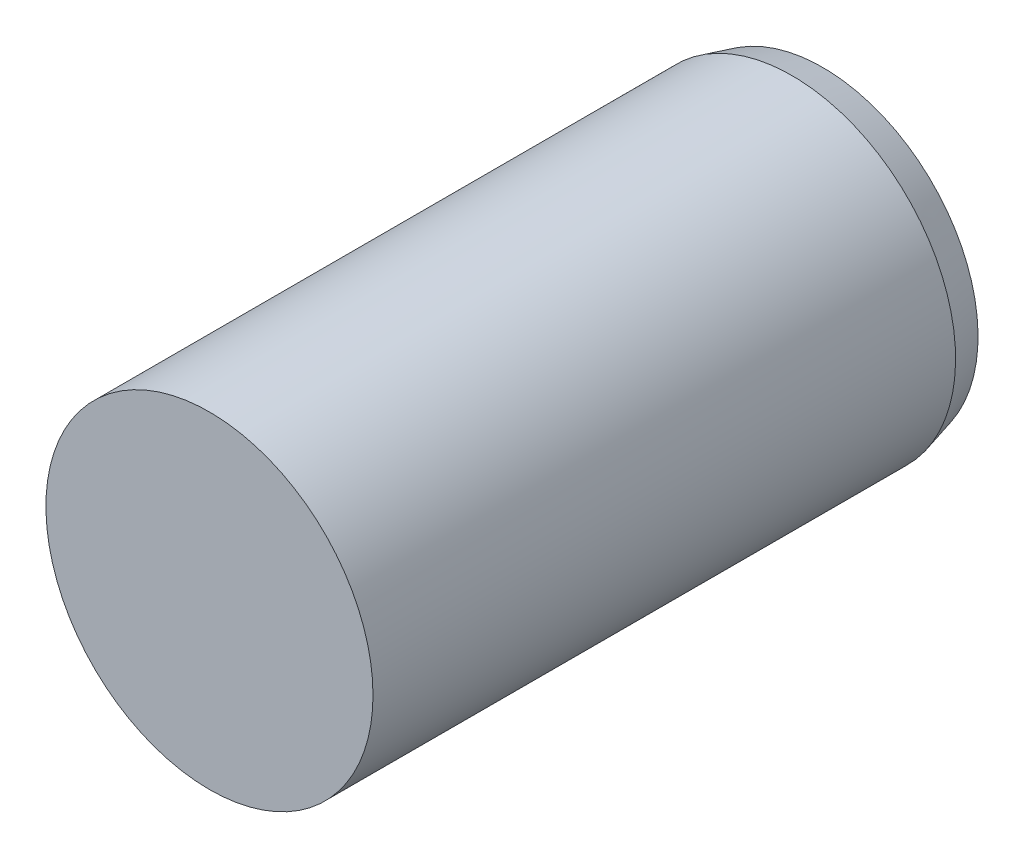
from build123d import *

# Parameters (mm, degrees)
CUT_EXTRUDE1_START = -0.79375
SKETCH4_R          = 3.175
CUT_EXTRUDE1_DEPTH = 0.79375


with BuildPart() as part:
    # Sketch3 → Revolve1 (revolve)
    with BuildSketch(Plane(origin=(0, 0, 0), x_dir=(0, 0, -1), z_dir=(1, 0, 0)), mode=Mode.PRIVATE) as revolve1_sk:
        Polygon((-6.35, 2.38125), (-5.55625, 3.175), (5.7546875, 3.175), (6.35, 3.015486496), (6.35, 0), (-6.35, 0), align=None)
    revolve(revolve1_sk.sketch.rotate(Axis((0, 0, 6.35), (0, 0, -1)), 180), axis=Axis((0, 0, 6.35), (0, 0, -1)))

    # Sketch4 → Cut-Extrude1 (cut)
    with BuildSketch(Plane.XY.offset(6.35).offset(CUT_EXTRUDE1_START)):
        with Locations(Location((0, 0, 0), (0, 0, 270))):
            Circle(SKETCH4_R)
    extrude(amount=CUT_EXTRUDE1_DEPTH, mode=Mode.SUBTRACT)


solid = part.part
